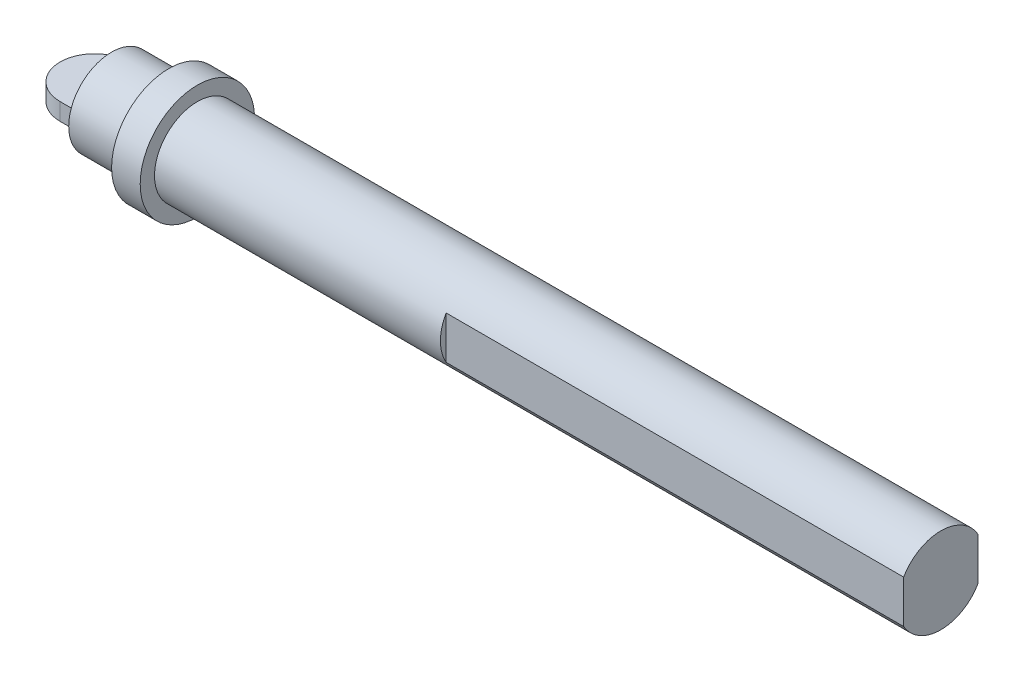
from build123d import *

# Parameters (mm, degrees)
SKETCH3_OUTSIDE_W   = 51.546
SKETCH3_OUTSIDE_H   = 51.546
CUT_EXTRUDE1_DEPTH  = 80
BOSS_EXTRUDE1_DEPTH = 1.5


with BuildPart() as part:
    # Sketch1 → Revolve1 (revolve)
    with BuildSketch(Plane.XY, mode=Mode.PRIVATE) as revolve1_sk:
        Polygon((0, 0), (0, 7.5), (10, 7.5), (10, 10), (15, 10), (15, 7.5), (145, 7.5), (145, 0), align=None)
    revolve(revolve1_sk.sketch.rotate(Axis((-72.886597938, 0, 0), (1, 0, 0)), 90), axis=Axis((-72.886597938, 0, 0), (1, 0, 0)))

    # Sketch3 outside → Cut-Extrude1 (cut)
    with BuildSketch(Plane(origin=(145, 0, 0), x_dir=(0, 0, -1), z_dir=(1, 0, 0))):
        Rectangle(SKETCH3_OUTSIDE_W, SKETCH3_OUTSIDE_H)
        with BuildLine():
            Line((-6.5, 3.741657387), (-6.5, -3.741657387))
            ThreePointArc((-6.5, -3.741657387), (0, -7.5), (6.5, -3.741657387))
            Line((6.5, -3.741657387), (6.5, 3.741657387))
            ThreePointArc((6.5, 3.741657387), (0, 7.5), (-6.5, 3.741657387))
        make_face(mode=Mode.SUBTRACT)
    extrude(amount=-CUT_EXTRUDE1_DEPTH, mode=Mode.SUBTRACT)

    # Sketch4 → Boss-Extrude1 (add, symmetric)
    with BuildSketch(Plane(origin=(0, 0, 0), x_dir=(1, 0, 0), z_dir=(0, 1, 0))):
        with BuildLine():
            Line((-3, 6), (0, 6))
            Line((0, 6), (0, -6))
            Line((0, -6), (-3, -6))
            ThreePointArc((-3, -6), (-9, 0), (-3, 6))
        make_face()
    extrude(amount=BOSS_EXTRUDE1_DEPTH, both=True)


solid = part.part
